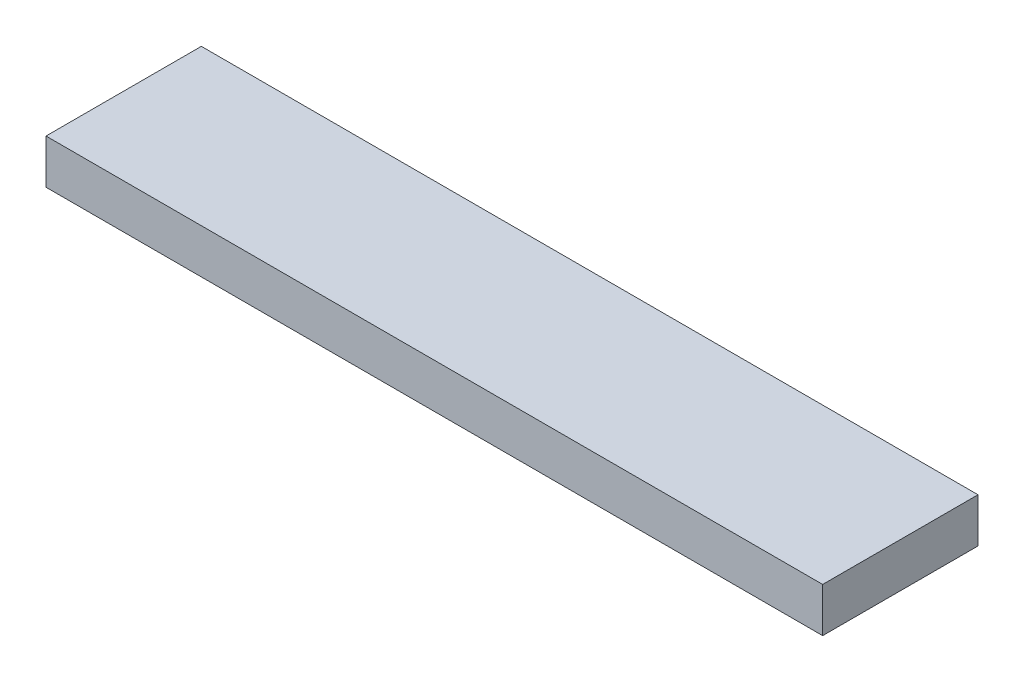
from build123d import *

# Parameters (mm, degrees)
SKETCH1_W           = 35
SKETCH1_H           = 7
BOSS_EXTRUDE1_DEPTH = 2


with BuildPart() as part:
    # Sketch1 → Boss-Extrude1 (new body)
    with BuildSketch(Plane(origin=(0, 0, 0), x_dir=(1, 0, 0), z_dir=(0, 1, 0))):
        Rectangle(SKETCH1_W, SKETCH1_H)
    extrude(amount=BOSS_EXTRUDE1_DEPTH)


solid = part.part
